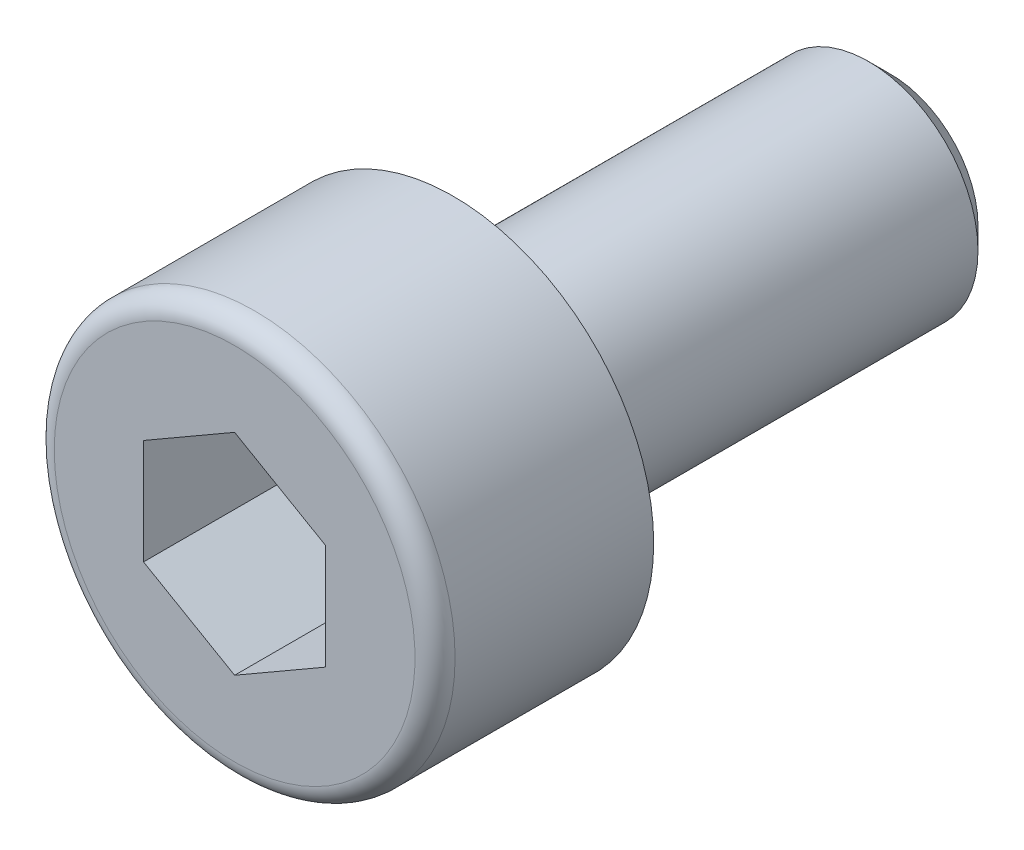
from build123d import *

# Parameters (mm, degrees)
CUT_EXTRUDE_1_DEPTH = 1.925
FILLET_1_R          = 0.275
CHAMFER_1_SIZE      = 0.3


with BuildPart() as part:
    # 草图3 → 旋转1 (revolve)
    with BuildSketch(Plane(origin=(0, 0, 0), x_dir=(0, 0, -1), z_dir=(1, 0, 0)), mode=Mode.PRIVATE) as revolve_1_sk:
        Polygon((-3, 0), (-3, 2.75), (0, 2.75), (0, 1.5), (6, 1.5), (6, 0), align=None)
    revolve(revolve_1_sk.sketch.rotate(Axis((0, 0, 3), (0, 0, -1)), 90), axis=Axis((0, 0, 3), (0, 0, -1)))

    # 草图4 → 切除-拉伸1 (cut)
    with BuildSketch(Plane.XY.offset(3)):
        Polygon((0, 1.443375673), (-1.25, 0.721687836), (-1.25, -0.721687836), (0, -1.443375673), (1.25, -0.721687836), (1.25, 0.721687836), align=None)
    extrude(amount=-CUT_EXTRUDE_1_DEPTH, mode=Mode.SUBTRACT)

    # 圆角1
    fillet_1_edges = [part.edges().sort_by_distance(p)[0] for p in [
        (-2.75, 0, 3),
    ]]
    fillet(fillet_1_edges, radius=FILLET_1_R)

    # 倒角1
    chamfer_1_edges = [part.edges().sort_by_distance(p)[0] for p in [
        (-1.5, 0, -6),
    ]]
    chamfer(chamfer_1_edges, length=CHAMFER_1_SIZE)


solid = part.part
